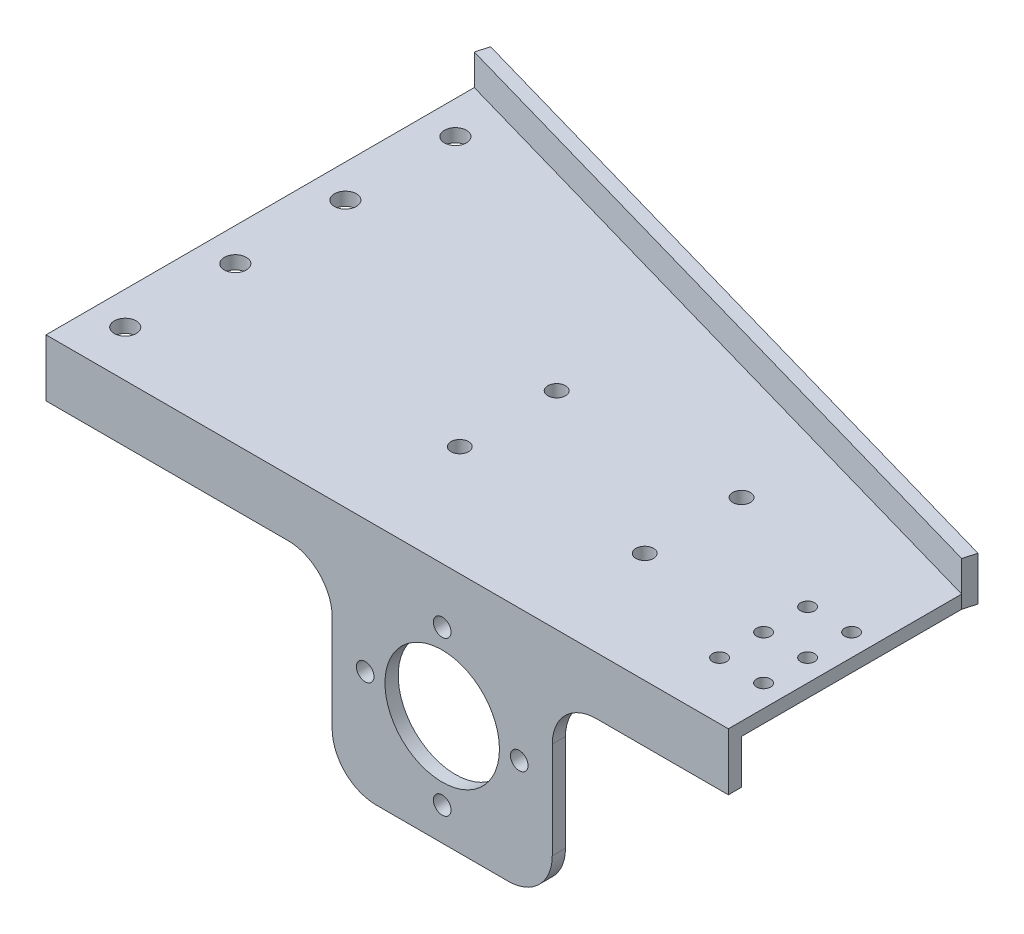
from build123d import *

# Parameters (mm, degrees)
EXTRUDE_1_DEPTH             = 3
HOLE_WIZARD_5_0_5_2_D       = 5
HOLE_WIZARD_3_2_3_2_2_D     = 3.2
PATTERN_LINEAR_1_COUNT      = 3
PATTERN_LINEAR_1_PITCH      = 10
PATTERN_LINEAR_1_COUNT_DIR2 = 2
PATTERN_LINEAR_1_PITCH_DIR2 = 10
SKETCH_8_W                  = 155
SKETCH_8_H                  = 3
EXTRUDE_2_DEPTH             = 13
SKETCH_10_W                 = 50
SKETCH_10_H                 = 3
EXTRUDE_3_DEPTH             = 55
EXTRUDE_5_DEPTH             = 10
SKETCH_12_R                 = 13
CUT_EXTRUDE_1_DEPTH         = 3
SKETCH_13_R                 = 2
CUT_EXTRUDE_2_DEPTH         = 3
PATTERN_CIRCULAR_1_COUNT    = 4
FILLET_1_R                  = 10
HOLE_WIZARD_4_0_4_1_D       = 4


with BuildPart() as part:
    # 草图1 → 凸台-拉伸1 (new body)
    with BuildSketch(Plane(origin=(0, 0, 0), x_dir=(1, 0, 0), z_dir=(0, 1, 0))):
        Polygon((-85, -45), (70, -45), (70, 5), (-70, 45), (-85, 45), align=None)
        Polygon((-85, 45), (-70, 45), (-85, 49.285714286), align=None)
    extrude(amount=EXTRUDE_1_DEPTH)

    # Ø5.0 (5) 直径孔2 (through all)
    with Locations(Plane(origin=(0, 3, 0), x_dir=(1, 0, 0), z_dir=(0, 1, 0))):
        with Locations((-77.5, -37.5), (-77.5, -12.5), (-77.5, 37.5), (-77.5, 12.5)):
            Hole(HOLE_WIZARD_5_0_5_2_D / 2)

    # Ø3.2 (3.2) 直径孔2 (through all)
    with Locations(Plane(origin=(0, 0, 0), x_dir=(-1, 0, 0), z_dir=(0, -1, 0))):
        with Locations((-65, -35)):
            hole_wizard_3_2_3_2_2 = Hole(HOLE_WIZARD_3_2_3_2_2_D / 2)

    # 阵列(线性)1: Hole Wizard 3.2 _3.2_ _2 3 × 2
    with Locations(*[(-j * PATTERN_LINEAR_1_PITCH_DIR2, 0, -i * PATTERN_LINEAR_1_PITCH) for i in range(PATTERN_LINEAR_1_COUNT) for j in range(PATTERN_LINEAR_1_COUNT_DIR2) if (i, j) != (0, 0)]):
        add(hole_wizard_3_2_3_2_2, mode=Mode.SUBTRACT)

    # 草图8 → 凸台-拉伸2 (add)
    with BuildSketch(Plane(origin=(0, 3, 0), x_dir=(1, 0, 0), z_dir=(0, 1, 0))):
        with Locations((-7.5, -46.5)):
            Rectangle(SKETCH_8_W, SKETCH_8_H)
    extrude(amount=-EXTRUDE_2_DEPTH)

    # 草图10 → 凸台-拉伸3 (add)
    with BuildSketch(Plane(origin=(0, 3, 0), x_dir=(1, 0, 0), z_dir=(0, 1, 0))):
        with Locations((5, -46.5)):
            Rectangle(SKETCH_10_W, SKETCH_10_H)
    extrude(amount=-EXTRUDE_3_DEPTH)

    # 草图11 → 凸台-拉伸5 (add)
    with BuildSketch(Plane(origin=(0, 0, 0), x_dir=(1, 0, 0), z_dir=(0, 1, 0))):
        Polygon((-85, 49.285714286), (-84.175836616, 52.170286129), (70.824163384, 7.884571843), (70, 5), align=None)
    extrude(amount=EXTRUDE_5_DEPTH)

    # 草图12 → 切除-拉伸1 (cut)
    with BuildSketch(Plane.XY.offset(48)):
        with Locations((5, -27)):
            Circle(SKETCH_12_R)
    extrude(amount=-CUT_EXTRUDE_1_DEPTH, mode=Mode.SUBTRACT)

    # 草图13 → 切除-拉伸2 (cut)
    with BuildSketch(Plane.XY.offset(48)):
        with Locations((5, -44.5)):
            Circle(SKETCH_13_R)
    cut_extrude_2 = extrude(amount=-CUT_EXTRUDE_2_DEPTH, mode=Mode.SUBTRACT)

    # 阵列(圆周)1: 切除-拉伸2 ×4 about axis
    pattern_circular_1_axis = Axis((5, -27, 0), (0, 0, 1))
    for i in range(1, PATTERN_CIRCULAR_1_COUNT):
        add(cut_extrude_2.rotate(pattern_circular_1_axis, i * 360 / PATTERN_CIRCULAR_1_COUNT), mode=Mode.SUBTRACT)

    # 圆角1
    fillet_1_edges = [part.edges().sort_by_distance(p)[0] for p in [
        (-20, -10, 46.5),
        (30, -10, 46.5),
        (30, -52, 46.5),
        (-20, -52, 46.5),
    ]]
    fillet(fillet_1_edges, radius=FILLET_1_R)

    # Ø4.0 (4) 直径孔1 (through all)
    with Locations(Plane(origin=(0, 0, 0), x_dir=(-1, 0, 0), z_dir=(0, -1, 0))):
        with Locations((16, -1), (-26, -23), (16, -23), (-26, -1)):
            Hole(HOLE_WIZARD_4_0_4_1_D / 2)


solid = part.part
